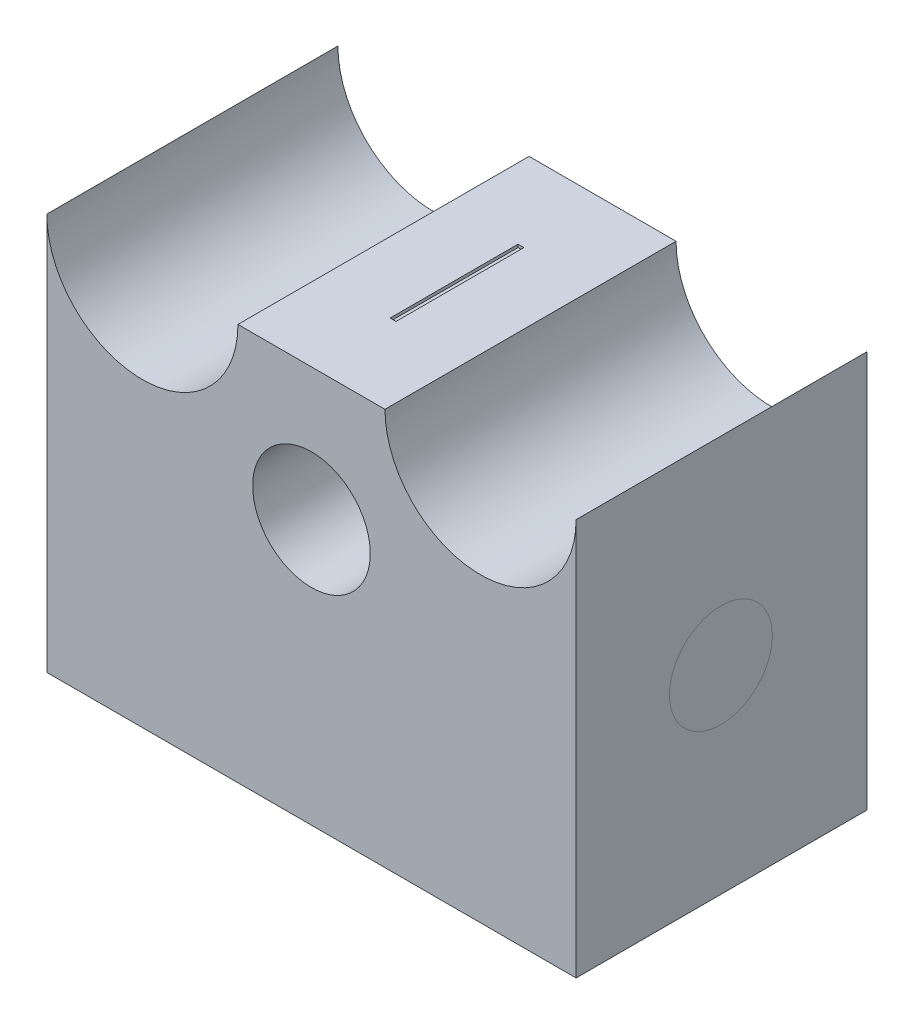
from build123d import *

# Parameters (mm, degrees)
SKETCH1_W              = 91.44
SKETCH1_H              = 68.58
BOSS_EXTRUDE1_DEPTH    = 50.292
SKETCH2_R              = 16.51
CUT_EXTRUDE1_DEPTH     = 125.875038595
SKETCH3_R              = 10.16
CUT_EXTRUDE2_DEPTH     = 125.875038595
SKETCH15_W             = 1.016
SKETCH15_H             = 22.098
CUT_EXTRUDE4_DEPTH     = 0.508
SPLIT1_SURFACE_1_BACK  = 125.875
SPLIT1_SURFACE_1_DEPTH = 251.75
SPLIT1_SURFACE_2_BACK  = 125.875
SPLIT1_SURFACE_2_DEPTH = 251.75
CUT_EXTRUDE3_DEPTH     = 0.508


with BuildPart() as part:
    # Sketch1 → Boss-Extrude1 (new body)
    with BuildSketch(Plane.XY):
        with Locations((45.72, 34.29)):
            Rectangle(SKETCH1_W, SKETCH1_H)
    extrude(amount=BOSS_EXTRUDE1_DEPTH)

    # Sketch2 → Cut-Extrude1 (cut, through all)
    with BuildSketch(Plane.XY.offset(50.292)):
        with Locations((16.51, 68.58)):
            Circle(SKETCH2_R)
        with Locations((74.93, 68.58)):
            Circle(SKETCH2_R)
    extrude(amount=-CUT_EXTRUDE1_DEPTH, mode=Mode.SUBTRACT)

    # Sketch3 → Cut-Extrude2 (cut, through all)
    with BuildSketch(Plane.XY.offset(50.292)):
        with Locations((45.72, 45.72)):
            Circle(SKETCH3_R)
    extrude(amount=-CUT_EXTRUDE2_DEPTH, mode=Mode.SUBTRACT)

    # Sketch11 → Cut-Revolve1 (revolve, cut)
    with BuildSketch(Plane.ZY.offset(-45.72)):
        with BuildLine():
            Line((0, 0), (33.02, 0))
            add(Edge.make_bspline(
                [(33.02, 0), (33.02, 22.86), (0, 22.86)],
                knots=[3.141592654, 3.141592654, 3.141592654, 4.71238898, 4.71238898, 4.71238898], degree=2, weights=[1, 0.707106781, 1]))
            Line((0, 22.86), (0, 0))
        make_face()
    revolve(axis=Axis((45.72, 0, 0), (0, 0, 1)), mode=Mode.SUBTRACT)

    # Sketch15 → Cut-Extrude4 (cut)
    with BuildSketch(Plane(origin=(0, 68.58, 0), x_dir=(1, 0, 0), z_dir=(0, 1, 0))):
        with Locations((45.72, -25.146)):
            Rectangle(SKETCH15_W, SKETCH15_H)
    extrude(amount=-CUT_EXTRUDE4_DEPTH, mode=Mode.SUBTRACT)


with BuildPart() as body_2:
    # Split1: the piece behind the surface
    add(part.part)
    # Split1 surface: a surface, the sketch's curves swept straight by 251.75 mm
    with BuildLine(Plane.ZY.offset(-SPLIT1_SURFACE_1_BACK), mode=Mode.PRIVATE) as split1_surface_1_path:
        CenterArc((25.273, 34.29), 8.89, 0, 360)
    split1_surface_1 = Shell.extrude(split1_surface_1_path.wire(), (-1 * SPLIT1_SURFACE_1_DEPTH, 0 * SPLIT1_SURFACE_1_DEPTH, 0 * SPLIT1_SURFACE_1_DEPTH))
    split(bisect_by=split1_surface_1, keep=Keep.BOTTOM)

    # Sketch12 → Cut-Extrude3 (cut)
    with BuildSketch(Plane.XZ):
        with BuildLine():
            Line((71.628, 0), (71.12, 0))
            add(Edge.make_bspline(
                [(71.12, 0), (71.12, 2.276244985), (70.964914115, 4.552443767), (70.349095665, 9.024340369), (69.888388082, 11.219955291), (68.674570464, 15.452776891), (67.921501402, 17.489932253), (66.143884943, 21.332719306), (65.119361513, 23.13835701), (62.826296857, 26.450561512), (61.55767782, 27.957189939), (58.810832755, 30.608298997), (57.332320888, 31.752755749), (54.212180089, 33.619562445), (52.570236556, 34.341466449), (49.192113285, 35.312061611), (47.456311718, 35.56), (45.72, 35.56)],
                knots=[0, 0, 0, 0, 0.125, 0.125, 0.25, 0.25, 0.375, 0.375, 0.5, 0.5, 0.625, 0.625, 0.75, 0.75, 0.875, 0.875, 1, 1, 1, 1], degree=3))
            add(Edge.make_bspline(
                [(45.72, 35.56), (43.983688282, 35.56), (42.247886715, 35.312061611), (38.869763444, 34.341466449), (37.227819911, 33.619562445), (34.107679112, 31.752755749), (32.629167245, 30.608298997), (29.88232218, 27.957189939), (28.613703143, 26.450561512), (26.320638487, 23.13835701), (25.296115057, 21.332719306), (23.518498598, 17.489932253), (22.765429536, 15.452776891), (21.551611918, 11.219955291), (21.090904335, 9.024340369), (20.475085885, 4.552443767), (20.32, 2.276244985), (20.32, 0)],
                knots=[0, 0, 0, 0, 0.125, 0.125, 0.25, 0.25, 0.375, 0.375, 0.5, 0.5, 0.625, 0.625, 0.75, 0.75, 0.875, 0.875, 1, 1, 1, 1], degree=3))
            Line((20.32, 0), (19.812, 0))
            add(Edge.make_bspline(
                [(45.72, 36.068), (42.144810252, 36.068), (35.052039646, 33.985545585), (26.542214261, 25.681133353), (21.987107711, 15.773212712), (20.125369552, 6.901184214), (19.812, 2.291209088), (19.812, 0)],
                knots=[0, 0, 0, 0, 0.25, 0.5, 0.75, 0.875, 1, 1, 1, 1], degree=3))
            add(Edge.make_bspline(
                [(71.628, 0), (71.628, 2.291209088), (71.314630448, 6.901184214), (69.452892289, 15.773212712), (64.897785739, 25.681133353), (56.387960354, 33.985545585), (49.295189748, 36.068), (45.72, 36.068)],
                knots=[0, 0, 0, 0, 0.125, 0.25, 0.5, 0.75, 1, 1, 1, 1], degree=3))
        make_face()
    extrude(amount=-CUT_EXTRUDE3_DEPTH, mode=Mode.SUBTRACT)


with BuildPart() as part_1:
    add(part.part)

    # Split1: split by a surface, the side it looks to stays
    # Split1 surface: a surface, the sketch's curves swept straight by 251.75 mm
    with BuildLine(Plane.ZY.offset(-SPLIT1_SURFACE_2_BACK), mode=Mode.PRIVATE) as split1_surface_2_path:
        CenterArc((25.273, 34.29), 8.89, 0, 360)
    split1_surface_2 = Shell.extrude(split1_surface_2_path.wire(), (-1 * SPLIT1_SURFACE_2_DEPTH, 0 * SPLIT1_SURFACE_2_DEPTH, 0 * SPLIT1_SURFACE_2_DEPTH))
    split(bisect_by=split1_surface_2, keep=Keep.TOP)


solid = Compound([body_2.part, part_1.part])
